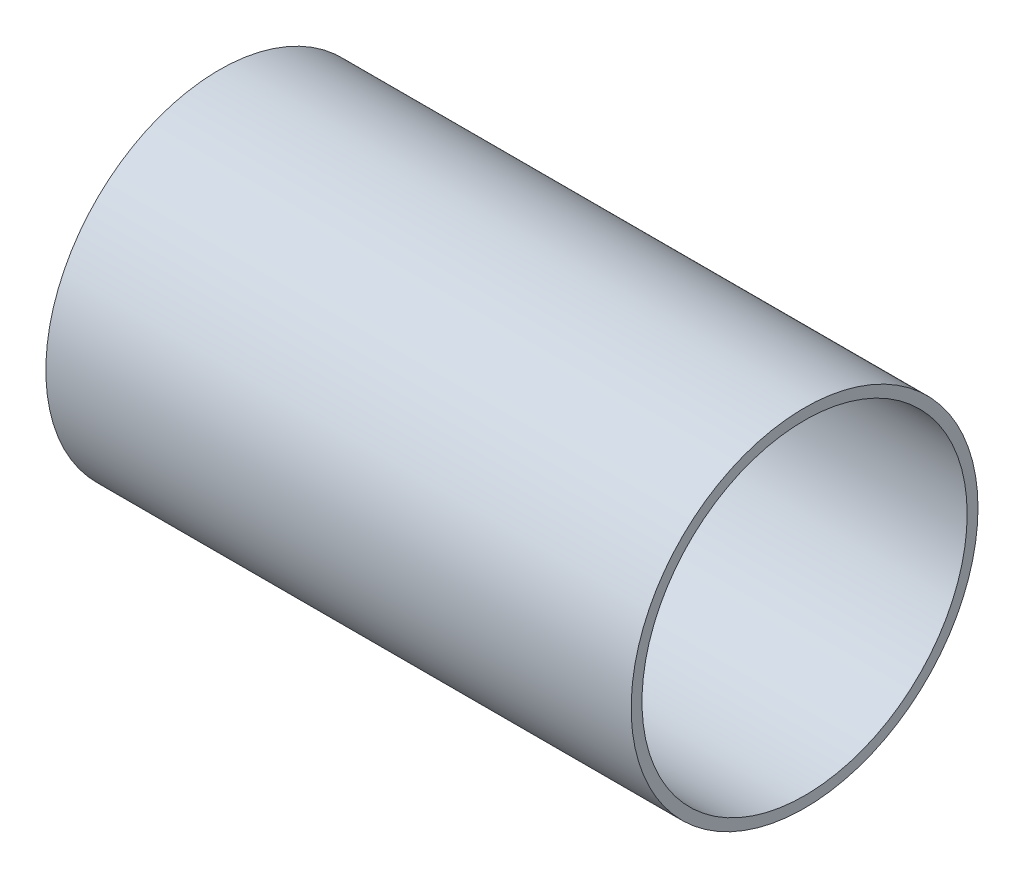
from build123d import *

# Parameters (mm, degrees)
SKETCH1_R      = 10.16
SKETCH1_R_2    = 9.525
EXTRUDE1_DEPTH = 34.29


with BuildPart() as part:
    # Sketch1 → Extrude1 (new body)
    with BuildSketch(Plane(origin=(0, 0, 0), x_dir=(0, 0, -1), z_dir=(1, 0, 0))):
        Circle(SKETCH1_R)
        Circle(SKETCH1_R_2, mode=Mode.SUBTRACT)
    extrude(amount=EXTRUDE1_DEPTH)


solid = part.part
